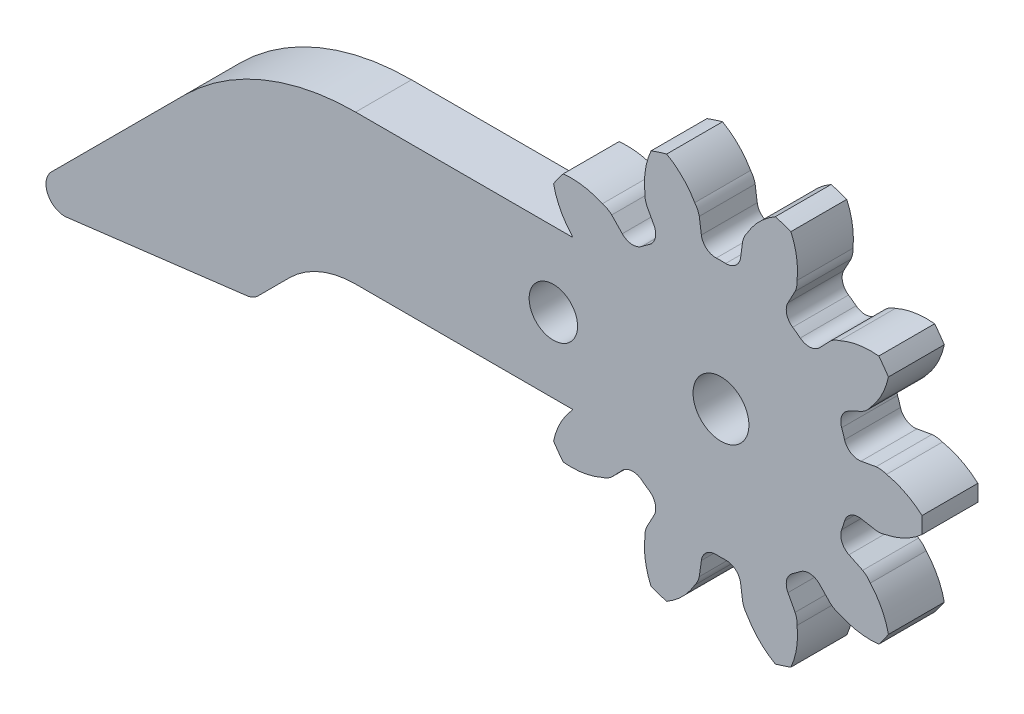
from build123d import *

# Parameters (mm, degrees)
POSICIONAMENTOS_R               = 6.8994
BASE_DEPTH                      = 3
BASE_DENTE_DEPTH                = 3
RAIO_DENTE_R                    = 0.778916794
PADR_OCIRCULAR1_COUNT           = 10
RAIO_DENTE_OF_PADR_OCIRCULAR1_R = 0.778916794
RESSALTO_EXTRUS_O3_DEPTH        = 3
FURO_DE_DI_METRO_3_0_3_1_D      = 3
FURO_DE_DI_METRO_2_6_2_6_1_D    = 2.6
FILETE2_R                       = 5
FILETE3_R                       = 13
FILETE4_R                       = 1


with BuildPart() as part:
    # Posicionamentos → Base (new body)
    with BuildSketch(Plane.XY):
        Circle(POSICIONAMENTOS_R)
    extrude(amount=BASE_DEPTH)

    # Dente → Base Dente (add, through all)
    with BuildSketch(Plane.XY):
        with BuildLine():
            Line((-1.165278514, 8.376570058), (-0.950632674, 6.833594799))
            ThreePointArc((-0.950632674, 6.833594799), (-2.132031851, 6.561719329), (-3.247608255, 6.087262191))
            Line((-3.247608255, 6.087262191), (-3.980894224, 7.461721056))
            ThreePointArc((-3.980894224, 7.461721056), (-4.065642913, 7.734315111), (-4.085914498, 8.019058718))
            ThreePointArc((-4.085914498, 8.019058718), (-4.059577631, 9.094601045), (-3.754624591, 10.126341599))
            ThreePointArc((-3.754624591, 10.126341599), (-3.337383539, 10.271410376), (-2.91455915, 10.399295407))
            ThreePointArc((-2.91455915, 10.399295407), (-2.061405076, 9.743846664), (-1.407910185, 8.889195065))
            ThreePointArc((-1.407910185, 8.889195065), (-1.256942149, 8.64691731), (-1.165278514, 8.376570058))
        make_face()
    base_dente = extrude(amount=BASE_DENTE_DEPTH)

    # Raio Dente
    raio_dente_edges = [part.edges().sort_by_distance(p)[0] for p in [
        (-3.247608255, 6.087262191, 1.5),
        (-0.950632674, 6.833594799, 1.5),
    ]]
    fillet(raio_dente_edges, radius=RAIO_DENTE_R)

    # PadrãoCircular1: Base Dente ×10 about axis, 1 skipped
    padr_ocircular1_axis = Axis((0, 0, 0), (0, 0, -1))
    add([base_dente.rotate(padr_ocircular1_axis, i * 360 / PADR_OCIRCULAR1_COUNT) for i in range(1, PADR_OCIRCULAR1_COUNT) if i not in (8,)])

    # Raio Dente of PadrãoCircular1
    raio_dente_of_padr_ocircular1_edges = [part.edges().sort_by_distance(p)[0] for p in [
        (0.950632674, 6.833594799, 1.5),
        (3.247608255, 6.087262191, 1.5),
        (4.785764232, 4.969726459, 1.5),
        (6.205373212, 3.015802325, 1.5),
        (6.792896515, 1.207591527, 1.5),
        (6.792896515, -1.207591527, 1.5),
        (6.205373212, -3.015802325, 1.5),
        (4.785764232, -4.969726459, 1.5),
        (3.247608255, -6.087262191, 1.5),
        (0.950632674, -6.833594799, 1.5),
        (-0.950632674, -6.833594799, 1.5),
        (-3.247608255, -6.087262191, 1.5),
        (-4.785764232, -4.969726459, 1.5),
        (-6.205373212, -3.015802325, 1.5),
        (-6.205373212, 3.015802325, 1.5),
        (-4.785764232, 4.969726459, 1.5),
    ]]
    fillet(raio_dente_of_padr_ocircular1_edges, radius=RAIO_DENTE_OF_PADR_OCIRCULAR1_R)

    # Braço → Ressalto-extrusão3 (add, through all)
    with BuildSketch(Plane.XY):
        Polygon((0, 4), (-25, 4), (-38, -9), (-25.102702489, -7.416410988), (-21.686291501, -4), (0, -4), align=None)
    extrude(amount=RESSALTO_EXTRUS_O3_DEPTH)

    # Furo de diâmetro Ø3.0 (3)1 (through all)
    with Locations(Plane.XY.offset(3)):
        with Locations((0, 0)):
            Hole(FURO_DE_DI_METRO_3_0_3_1_D / 2)

    # Furo de diâmetro Ø2.6 (2.6)1 (through all)
    with Locations(Plane.XY.offset(3)):
        with Locations((-9, 0)):
            Hole(FURO_DE_DI_METRO_2_6_2_6_1_D / 2)

    # Filete2
    filete2_edges = [part.edges().sort_by_distance(p)[0] for p in [
        (-21.686291501, -4, 1.5),
    ]]
    fillet(filete2_edges, radius=FILETE2_R)

    # Filete3
    filete3_edges = [part.edges().sort_by_distance(p)[0] for p in [
        (-25, 4, 1.5),
    ]]
    fillet(filete3_edges, radius=FILETE3_R)

    # Filete4
    filete4_edges = [part.edges().sort_by_distance(p)[0] for p in [
        (-25.102702489, -7.416410988, 1.5),
        (-38, -9, 1.5),
    ]]
    fillet(filete4_edges, radius=FILETE4_R)


solid = part.part
